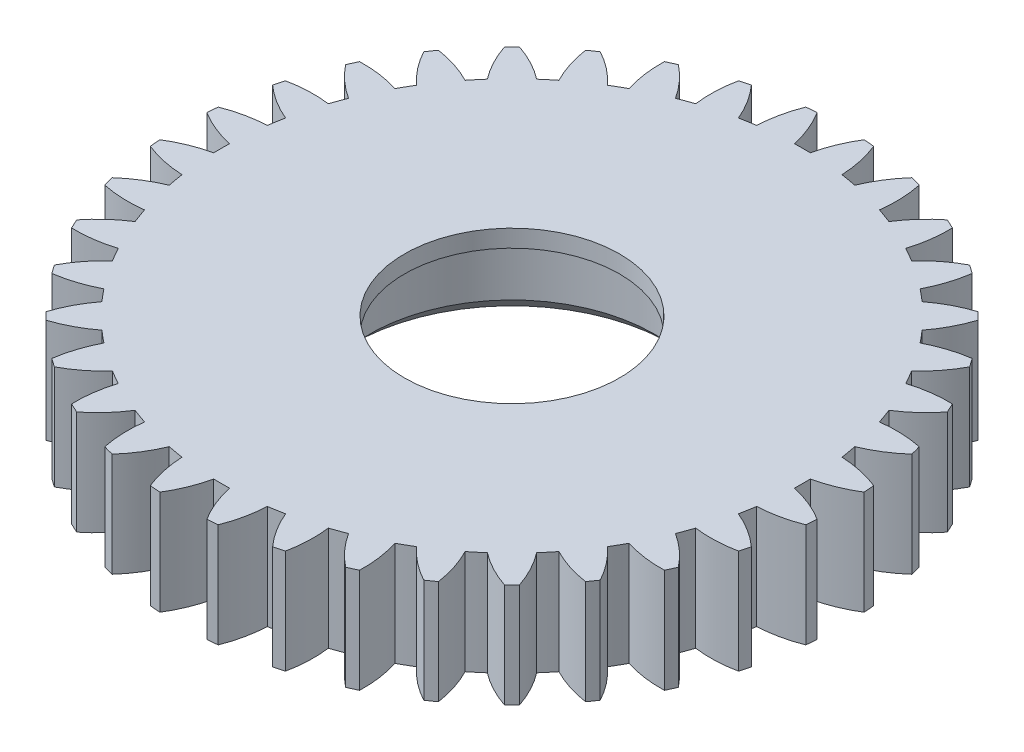
from build123d import *

# Parameters (mm, degrees)
SKETCH1_R           = 19
BOSS_EXTRUDE1_DEPTH = 6
CUT_EXTRUDE1_DEPTH  = 6
CIRPATTERN1_COUNT   = 36
SKETCH3_R           = 8.2
CUT_EXTRUDE2_DEPTH  = 28.465150249
SKETCH4_R           = 8.2
SKETCH4_R_2         = 6.2
BOSS_EXTRUDE2_DEPTH = 1
CHAMFER1_SIZE       = 1


with BuildPart() as part:
    # Sketch1 → Boss-Extrude1 (new body)
    with BuildSketch(Plane(origin=(0, 0, 0), x_dir=(1, 0, 0), z_dir=(0, 1, 0))):
        with Locations(Location((0, 0, 0), (0, 0, 270))):
            Circle(SKETCH1_R)
    extrude(amount=BOSS_EXTRUDE1_DEPTH)

    # Sketch2 → Cut-Extrude1 (cut)
    with BuildSketch(Plane(origin=(0, 6, 0), x_dir=(1, 0, 0), z_dir=(0, 1, 0))):
        with BuildLine():
            ThreePointArc((0.454664826, 16.742827745), (0, 16.749), (-0.454664826, 16.742827745))
            ThreePointArc((-0.454664826, 16.742827745), (-0.817558311, 17.898033097), (-1.368909141, 18.976088452))
            ThreePointArc((-1.368909141, 18.976088452), (0, 19.0254), (1.368909141, 18.976088452))
            ThreePointArc((1.368909141, 18.976088452), (0.817558311, 17.898033097), (0.454664826, 16.742827745))
        make_face()
    cut_extrude1 = extrude(amount=-CUT_EXTRUDE1_DEPTH, mode=Mode.SUBTRACT)

    # CirPattern1: Cut-Extrude1 ×36 about axis
    cirpattern1_axis = Axis((0, 0, 0), (0, 1, 0))
    for i in range(1, CIRPATTERN1_COUNT):
        add(cut_extrude1.rotate(cirpattern1_axis, i * 360 / CIRPATTERN1_COUNT), mode=Mode.SUBTRACT)

    # Sketch3 → Cut-Extrude2 (cut, through all)
    with BuildSketch(Plane(origin=(0, 6, 0), x_dir=(1, 0, 0), z_dir=(0, 1, 0))):
        with Locations(Location((0, 0, 0), (0, 0, 270))):
            Circle(SKETCH3_R)
    extrude(amount=-CUT_EXTRUDE2_DEPTH, mode=Mode.SUBTRACT)

    # Sketch4 → Boss-Extrude2 (add)
    with BuildSketch(Plane(origin=(0, 6, 0), x_dir=(1, 0, 0), z_dir=(0, 1, 0))):
        with Locations(Location((0, 0, 0), (0, 0, 270))):
            Circle(SKETCH4_R)
        with Locations(Location((0, 0, 0), (0, 0, 270))):
            Circle(SKETCH4_R_2, mode=Mode.SUBTRACT)
    extrude(amount=-BOSS_EXTRUDE2_DEPTH)

    # Chamfer1
    chamfer1_edges = [part.edges().sort_by_distance(p)[0] for p in [
        (0, 0, -8.2),
    ]]
    chamfer(chamfer1_edges, length=CHAMFER1_SIZE)


solid = part.part
